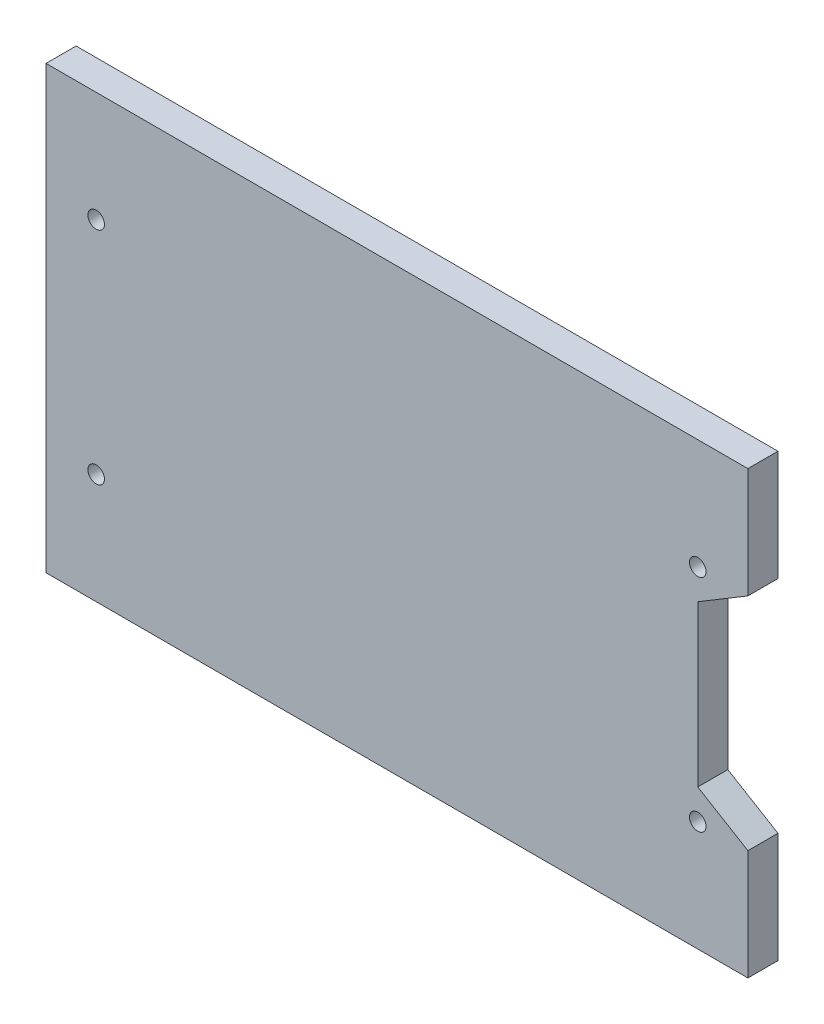
from build123d import *

# Parameters (mm, degrees)
SKETCH1_R           = 1.65
BOSS_EXTRUDE1_DEPTH = 6


with BuildPart() as part:
    # Sketch1 → Boss-Extrude1 (new body)
    with BuildSketch(Plane.XY):
        Polygon((0, 0), (140, 1.2e-05), (139.99998, 22.000012), (130, 28), (130, 60), (139.99998, 65.999988), (140, 87.999988), (0, 88), align=None)
        with Locations((10, 22)):
            Circle(SKETCH1_R, mode=Mode.SUBTRACT)
        with Locations(Location((130, 66, 0), (0, 0, 180))):
            Circle(SKETCH1_R, mode=Mode.SUBTRACT)
        with Locations((130, 22)):
            Circle(SKETCH1_R, mode=Mode.SUBTRACT)
        with Locations(Location((10, 66, 0), (0, 0, 180))):
            Circle(SKETCH1_R, mode=Mode.SUBTRACT)
    extrude(amount=BOSS_EXTRUDE1_DEPTH)


solid = part.part
